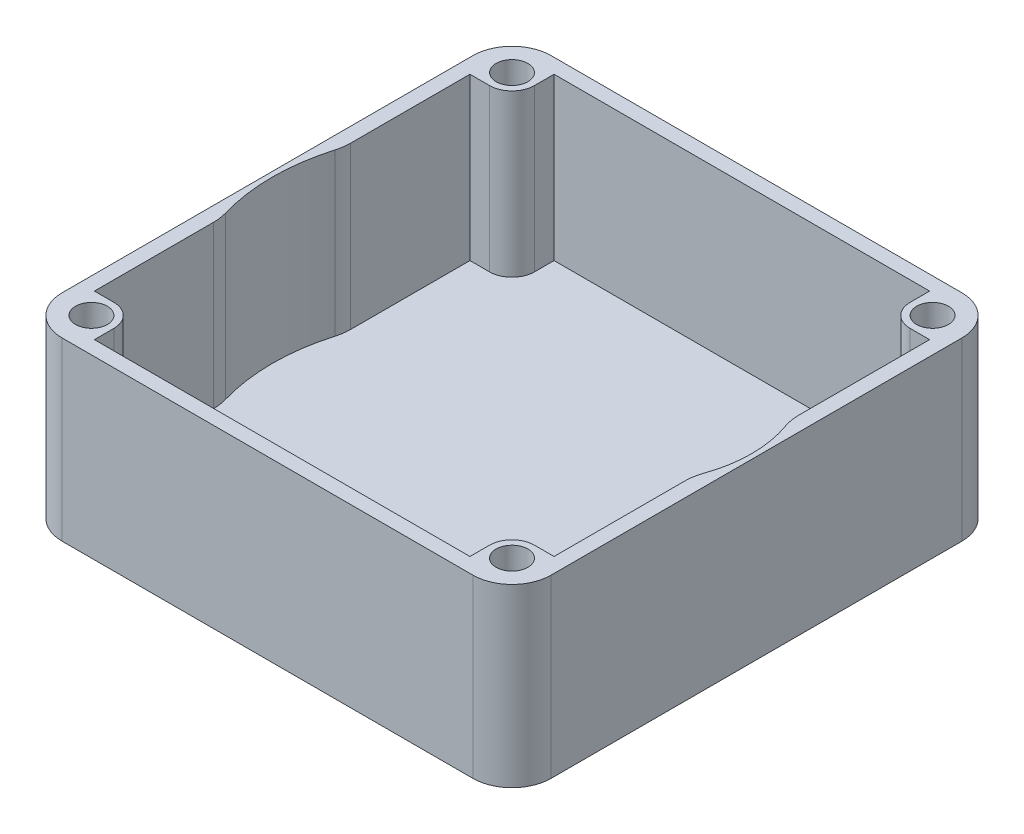
from build123d import *

# Parameters (mm, degrees)
SKETCH_1_W      = 100
SKETCH_1_H      = 100
EXTRUDE_1_DEPTH = 3
SKETCH_4_W      = 100
SKETCH_4_H      = 100
EXTRUDE_4_DEPTH = 33
FILLET_3_R      = 8
SKETCH_7_R      = 3.25
EXTRUDE_6_DEPTH = 33


with BuildPart() as part:
    # Эскиз1 → Бобышка-Вытянуть1 (new body)
    with BuildSketch(Plane(origin=(0, 0, 0), x_dir=(1, 0, 0), z_dir=(0, 1, 0))):
        with Locations((50, 50)):
            Rectangle(SKETCH_1_W, SKETCH_1_H)
    extrude(amount=EXTRUDE_1_DEPTH)

    # Эскиз4 → Бобышка-Вытянуть4 (add)
    with BuildSketch(Plane(origin=(0, 3, 0), x_dir=(1, 0, 0), z_dir=(0, 1, 0))):
        with Locations((50, 50)):
            Rectangle(SKETCH_4_W, SKETCH_4_H)
        with BuildLine():
            Line((97, 97), (3, 97))
            Line((3, 97), (3, 64))
            ThreePointArc((3, 64), (2.899494937, 62.585786438), (2.6, 61.2))
            ThreePointArc((2.6, 61.2), (1, 50), (2.6, 38.8))
            ThreePointArc((2.6, 38.8), (2.899494937, 37.414213562), (3, 36))
            Line((3, 36), (3, 3))
            Line((3, 3), (97, 3))
            Line((97, 3), (97, 38.33809621))
            ThreePointArc((97, 38.33809621), (97.143892394, 40.02840472), (97.571428571, 41.670068722))
            ThreePointArc((97.571428571, 41.670068722), (99, 50), (97.571428571, 58.329931278))
            ThreePointArc((97.571428571, 58.329931278), (97.143892394, 59.97159528), (97, 61.66190379))
            Line((97, 61.66190379), (97, 97))
        make_face(mode=Mode.SUBTRACT)
    extrude(amount=EXTRUDE_4_DEPTH)

    # Скругление3
    fillet_3_edges = [part.edges().sort_by_distance(p)[0] for p in [
        (0, 18, -100),
        (100, 18, -100),
        (100, 18, 0),
        (0, 18, 0),
    ]]
    fillet(fillet_3_edges, radius=FILLET_3_R)

    # Эскиз7 → Бобышка-Вытянуть6 (add)
    # profile 1 of 4: a face of its own
    with BuildSketch(Plane(origin=(0, 3, 0), x_dir=(1, 0, 0), z_dir=(0, 1, 0))):
        with BuildLine():
            Line((7, 88.4), (2.4, 88.4))
            Line((2.4, 88.4), (2.4, 97.6))
            Line((2.4, 97.6), (11.6, 97.6))
            Line((11.6, 97.6), (11.6, 93))
            ThreePointArc((11.6, 93), (10.252691193, 89.747308807), (7, 88.4))
        make_face()
        with Locations(Location((7, 93, 0), (0, 0, 270))):
            Circle(SKETCH_7_R, mode=Mode.SUBTRACT)
    # profile 2 of 4: a face of its own
    with BuildSketch(Plane(origin=(0, 3, 0), x_dir=(1, 0, 0), z_dir=(0, 1, 0))):
        with BuildLine():
            Line((93, 88.4), (97.6, 88.4))
            Line((97.6, 88.4), (97.6, 97.6))
            Line((97.6, 97.6), (88.4, 97.6))
            Line((88.4, 97.6), (88.4, 93))
            ThreePointArc((88.4, 93), (89.747308807, 89.747308807), (93, 88.4))
        make_face()
        with Locations(Location((93, 93, 0), (0, 0, 90))):
            Circle(SKETCH_7_R, mode=Mode.SUBTRACT)
    # profile 3 of 4: a face of its own
    with BuildSketch(Plane(origin=(0, 3, 0), x_dir=(1, 0, 0), z_dir=(0, 1, 0))):
        with BuildLine():
            Line((88.4, 7), (88.4, 2.4))
            Line((88.4, 2.4), (97.6, 2.4))
            Line((97.6, 2.4), (97.6, 11.6))
            Line((97.6, 11.6), (93, 11.6))
            ThreePointArc((93, 11.6), (89.747308807, 10.252691193), (88.4, 7))
        make_face()
        with Locations(Location((93, 7, 0), (0, 0, 270))):
            Circle(SKETCH_7_R, mode=Mode.SUBTRACT)
    # profile 4 of 4: a face of its own
    with BuildSketch(Plane(origin=(0, 3, 0), x_dir=(1, 0, 0), z_dir=(0, 1, 0))):
        with BuildLine():
            Line((11.6, 7), (11.6, 2.4))
            Line((11.6, 2.4), (2.4, 2.4))
            Line((2.4, 2.4), (2.4, 11.6))
            Line((2.4, 11.6), (7, 11.6))
            ThreePointArc((7, 11.6), (10.252691193, 10.252691193), (11.6, 7))
        make_face()
        with Locations(Location((7, 7, 0), (0, 0, 90))):
            Circle(SKETCH_7_R, mode=Mode.SUBTRACT)
    extrude(amount=EXTRUDE_6_DEPTH)


solid = part.part
